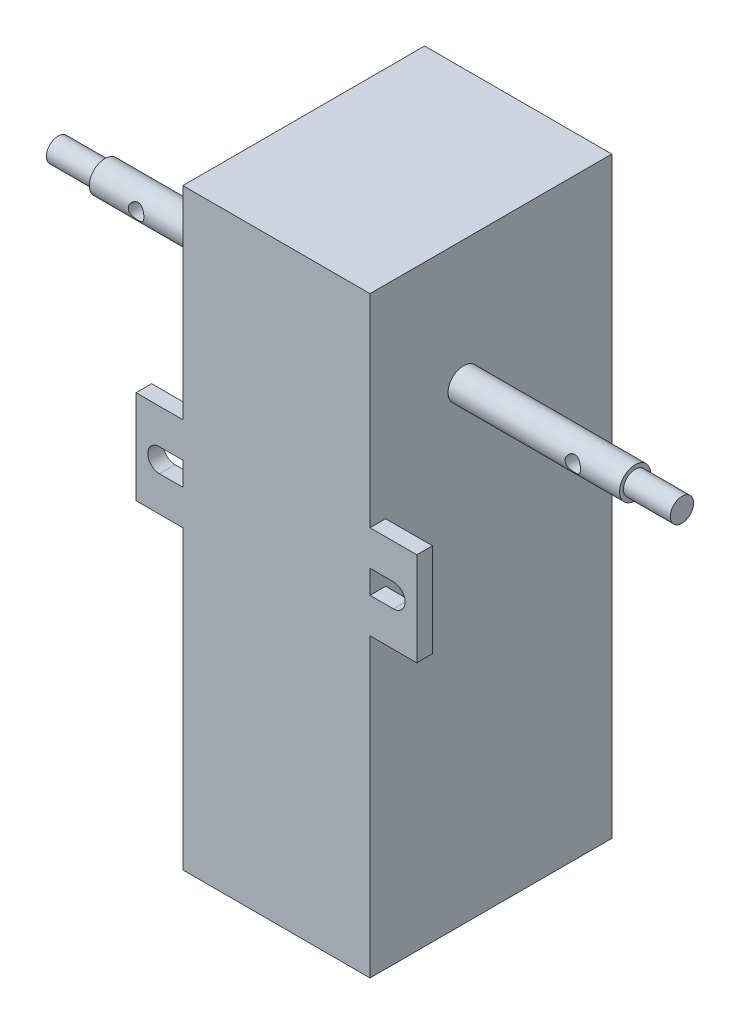
from build123d import *

# Parameters (mm, degrees)
SKETCH1_W                = 24
SKETCH1_H                = 31
BOSS_EXTRUDE1_DEPTH      = 76
BOSS_EXTRUDE2_DEPTH      = 28
BOSS_EXTRUDE2_DEPTH_BACK = 52
SKETCH2_R                = 2
SKETCH7_R                = 2
SKETCH7_R_2              = 1.5
CUT_EXTRUDE1_DEPTH       = 6
SKETCH17_R               = 1
CUT_EXTRUDE3_DEPTH       = 88.271129247
SKETCH18_W               = 2
SKETCH18_H               = 12
BOSS_EXTRUDE3_DEPTH      = 6
CUT_EXTRUDE4_REACH       = 93.307


with BuildPart() as part:
    # Sketch1 → Boss-Extrude1 (new body)
    with BuildSketch(Plane(origin=(0, 0, 0), x_dir=(1, 0, 0), z_dir=(0, 1, 0))):
        Rectangle(SKETCH1_W, SKETCH1_H)
    extrude(amount=BOSS_EXTRUDE1_DEPTH)

    # Sketch2 → Boss-Extrude2 (add, two sides: drawn at the far end of the back side and taken through both)
    with BuildSketch(Plane(origin=(12, 0, 0), x_dir=(0, 0, -1), z_dir=(1, 0, 0)).offset(-BOSS_EXTRUDE2_DEPTH_BACK)):
        with Locations((-3.5, 60)):
            Circle(SKETCH2_R)
    extrude(amount=BOSS_EXTRUDE2_DEPTH + BOSS_EXTRUDE2_DEPTH_BACK)

    # Sketch7 → Cut-Extrude1 (cut)
    with BuildSketch(Plane.ZY.offset(40)):
        with Locations(Location((3.5, 60, 0), (0, 0, 180))):
            Circle(SKETCH7_R)
        with Locations((3.5, 60)):
            Circle(SKETCH7_R_2, mode=Mode.SUBTRACT)
    cut_extrude1 = extrude(amount=-CUT_EXTRUDE1_DEPTH, mode=Mode.SUBTRACT)

    # Sketch17 → Cut-Extrude3 (cut, through all)
    with BuildSketch(Plane.XY):
        with Locations(Location((-28, 60, 0), (0, 0, 180))):
            Circle(SKETCH17_R)
    cut_extrude3 = extrude(amount=CUT_EXTRUDE3_DEPTH, mode=Mode.SUBTRACT)

    # Mirror7: Cut-Extrude1 across plane
    add(cut_extrude1.mirror(Plane(origin=(0, 0, 0), x_dir=(0, 0, 1), z_dir=(1, 0, 0))), mode=Mode.SUBTRACT)

    # Sketch18 → Boss-Extrude3 (add)
    with BuildSketch(Plane(origin=(12, 0, 0), x_dir=(0, 0, -1), z_dir=(1, 0, 0))):
        with Locations((-14.5, 44)):
            Rectangle(SKETCH18_W, SKETCH18_H)
    boss_extrude3 = extrude(amount=BOSS_EXTRUDE3_DEPTH)

    # Sketch19 → Cut-Extrude4 (cut, up to next)
    with BuildSketch(Plane.XY.offset(15.5), mode=Mode.PRIVATE) as cut_extrude4_sk1:
        with BuildLine():
            Line((12, 45.5), (15, 45.5))
            ThreePointArc((15, 45.5), (16.5, 44), (15, 42.5))
            Line((15, 42.5), (12, 42.5))
            Line((12, 42.5), (12, 45.5))
        make_face()
    cut_extrude4_tool1 = extrude(cut_extrude4_sk1.sketch, amount=-CUT_EXTRUDE4_REACH, mode=Mode.PRIVATE) & part.part
    cut_extrude4 = cut_extrude4_tool1.solids().sort_by_distance((14.102462, 44, 15.5))[0]
    add(cut_extrude4, mode=Mode.SUBTRACT)

    # Mirror8: Boss-Extrude3, Cut-Extrude4 across plane
    add(boss_extrude3.mirror(Plane(origin=(0, 0, 0), x_dir=(0, 0, 1), z_dir=(1, 0, 0))))
    add(cut_extrude4.mirror(Plane(origin=(0, 0, 0), x_dir=(0, 0, 1), z_dir=(1, 0, 0))), mode=Mode.SUBTRACT)

    # Mirror9: Cut-Extrude3 across plane
    add(cut_extrude3.mirror(Plane(origin=(0, 0, 0), x_dir=(0, 0, 1), z_dir=(1, 0, 0))), mode=Mode.SUBTRACT)


solid = part.part
